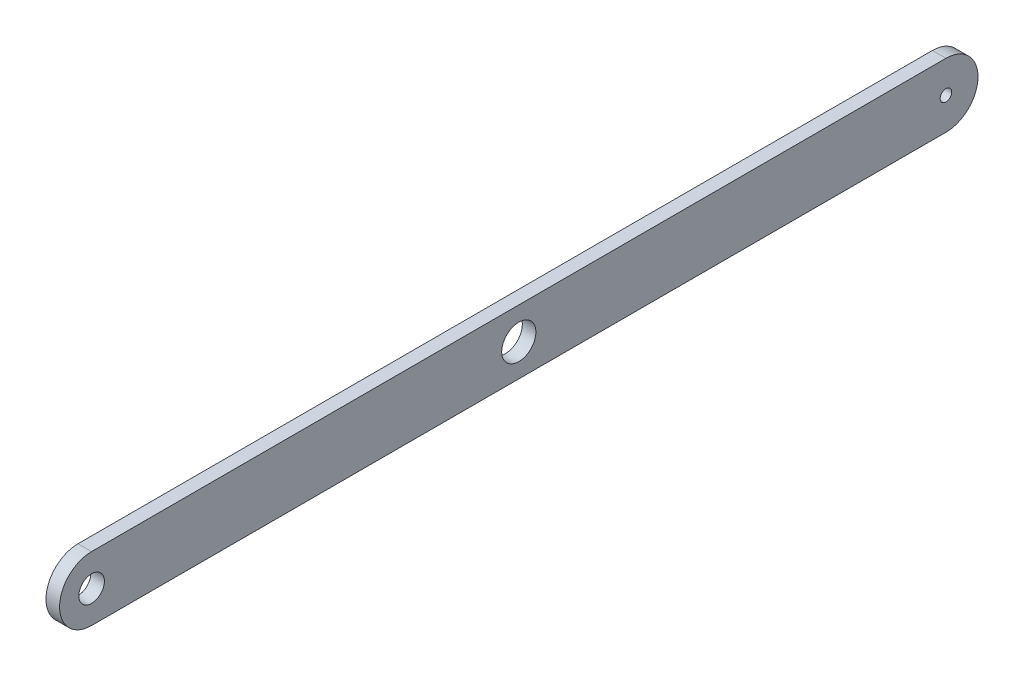
from build123d import *

# Parameters (mm, degrees)
SKETCH1_R             = 3
SKETCH1_R_2           = 4
BOSS_EXTRUDE1_DEPTH   = 3.175
F_6_32_TAPPED_HOLE1_D = 2.7051


with BuildPart() as part:
    # Sketch1 → Boss-Extrude1 (new body)
    with BuildSketch(Plane(origin=(0, 0, 0), x_dir=(0, 0, -1), z_dir=(1, 0, 0))):
        with BuildLine():
            Line((-100, 7.5), (100, 7.5))
            ThreePointArc((100, 7.5), (107.5, 0), (100, -7.5))
            Line((100, -7.5), (-100, -7.5))
            ThreePointArc((-100, -7.5), (-107.5, 0), (-100, 7.5))
        make_face()
        with Locations((-100, 0)):
            Circle(SKETCH1_R, mode=Mode.SUBTRACT)
        Circle(SKETCH1_R_2, mode=Mode.SUBTRACT)
    extrude(amount=BOSS_EXTRUDE1_DEPTH)

    # #6-32 Tapped Hole1 (through all)
    with Locations(Plane(origin=(3.175, 0, 0), x_dir=(0, 0, -1), z_dir=(1, 0, 0))):
        with Locations((100, 0)):
            Hole(F_6_32_TAPPED_HOLE1_D / 2)


solid = part.part
